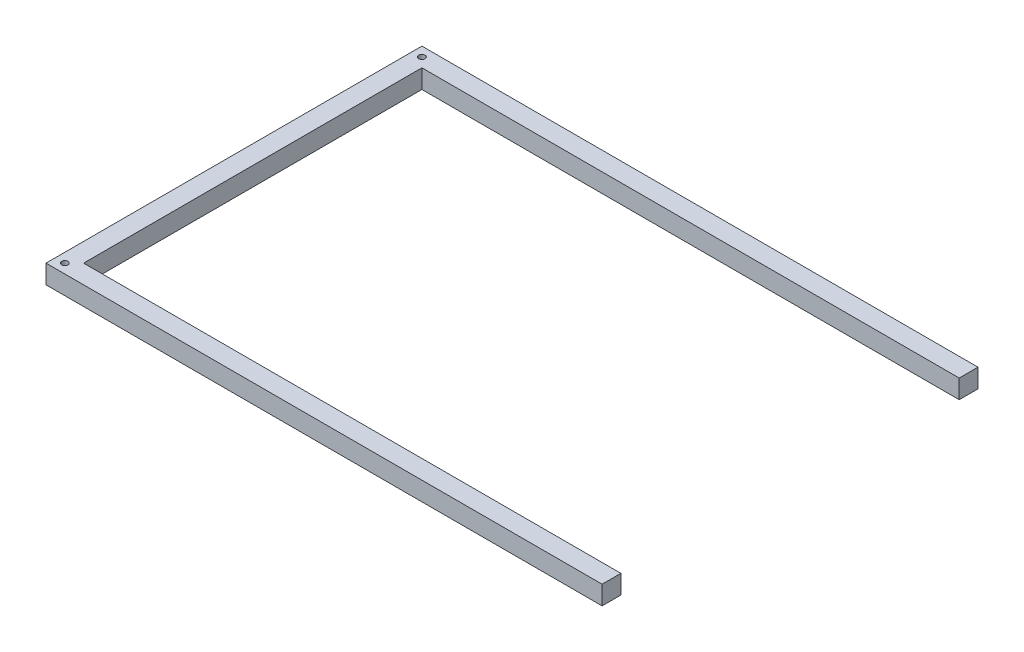
from build123d import *

# Parameters (mm, degrees)
SKETCH1_R           = 0.5
BOSS_EXTRUDE1_DEPTH = 3


with BuildPart() as part:
    # Sketch1 → Boss-Extrude1 (new body)
    with BuildSketch(Plane(origin=(0, 0, 0), x_dir=(1, 0, 0), z_dir=(0, 1, 0))):
        Polygon((42.8625, 26.9875), (42.8625, 29.9875), (-45.8625, 29.9875), (-45.8625, -29.9875), (42.8625, -29.9875), (42.8625, -26.9875), (-42.8625, -26.9875), (-42.8625, 26.9875), align=None)
        with Locations(Location((-44.3625, 28.4875, 0), (0, 0, 270))):
            Circle(SKETCH1_R, mode=Mode.SUBTRACT)
        with Locations(Location((-44.3625, -28.4875, 0), (0, 0, 270))):
            Circle(SKETCH1_R, mode=Mode.SUBTRACT)
    extrude(amount=BOSS_EXTRUDE1_DEPTH)


solid = part.part
